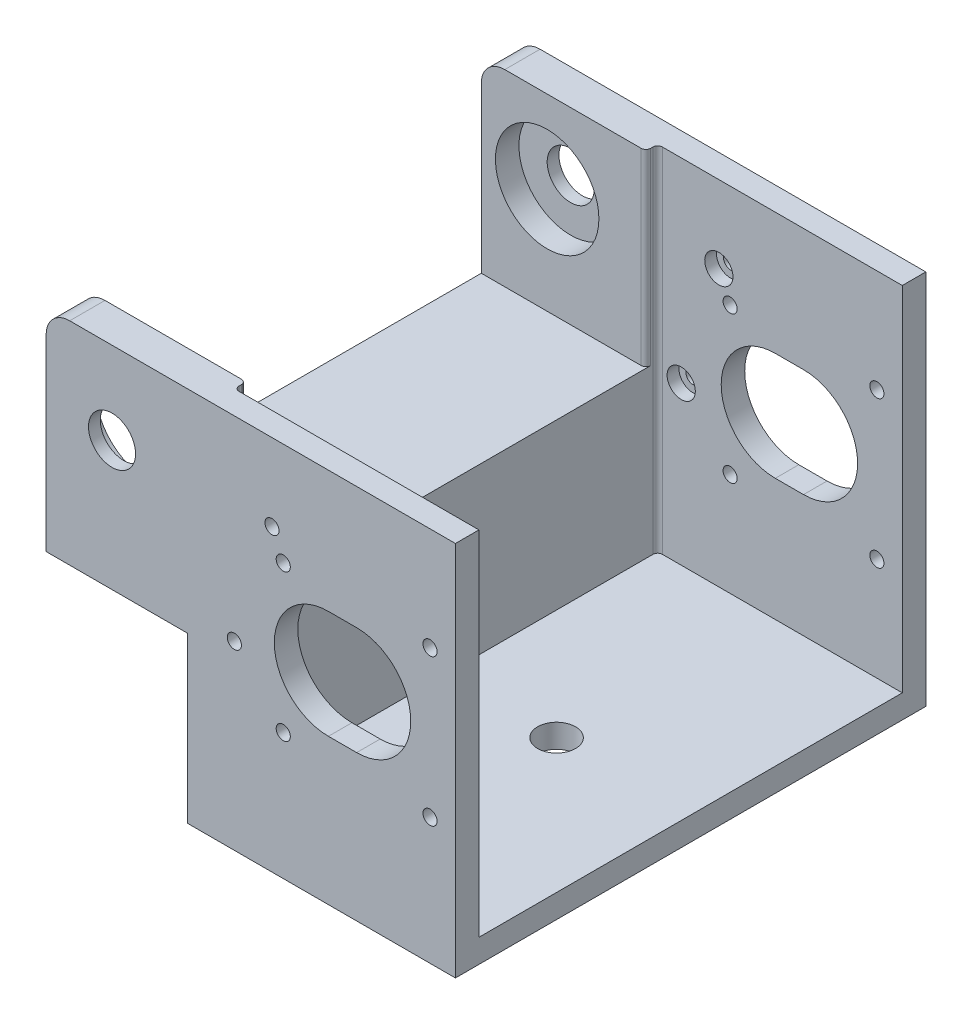
from build123d import *

# Parameters (mm, degrees)
SKETCH1_W           = 57
SKETCH1_H           = 100
BOSS_EXTRUDE1_DEPTH = 80
SKETCH3_W           = 75
SKETCH3_H           = 90
CUT_EXTRUDE1_DEPTH  = 52
SKETCH4_R           = 4.025
CUT_EXTRUDE2_DEPTH  = 114.213294272
BOSS_EXTRUDE2_DEPTH = 30
CUT_EXTRUDE5_REACH  = 112.223
SKETCH8_W           = 85
SKETCH8_H           = 40
SKETCH5_R           = 5
SKETCH5_R_2         = 1.5
CUT_EXTRUDE3_DEPTH  = 141.791512528
SKETCH9_R           = 11
SKETCH9_R_2         = 3
CUT_EXTRUDE6_DEPTH  = 47.5
FILLET1_R           = 1
FILLET2_R           = 5


with BuildPart() as part:
    # Sketch1 → Boss-Extrude1 (new body)
    with BuildSketch(Plane(origin=(0, 0, 0), x_dir=(1, 0, 0), z_dir=(0, 1, 0))):
        Rectangle(SKETCH1_W, SKETCH1_H)
    extrude(amount=BOSS_EXTRUDE1_DEPTH)

    # Sketch3 → Cut-Extrude1 (cut)
    with BuildSketch(Plane(origin=(28.5, 40, 0), x_dir=(0, 1, 0), z_dir=(-1, 0, 0))):
        with Locations((2.5, 0)):
            Rectangle(SKETCH3_W, SKETCH3_H)
    extrude(amount=CUT_EXTRUDE1_DEPTH, mode=Mode.SUBTRACT)

    # Sketch4 → Cut-Extrude2 (cut, through all)
    with BuildSketch(Plane(origin=(-40, 5, 0), x_dir=(-1, 0, 0), z_dir=(0, -1, 0))):
        with Locations(Location((-40, 0, 0), (0, 0, 90))):
            Circle(SKETCH4_R)
    extrude(amount=CUT_EXTRUDE2_DEPTH, mode=Mode.SUBTRACT)

    # Sketch7 → Boss-Extrude2 (add)
    with BuildSketch(Plane.ZY.offset(28.5)):
        Polygon((-50, 80), (-42.5, 80), (-42.5, 40), (42.5, 40), (42.5, 80), (50, 80), (50, 35), (-50, 35), align=None)
    extrude(amount=BOSS_EXTRUDE2_DEPTH)

    # Sketch8 → Cut-Extrude5 (cut, up to next)
    with BuildSketch(Plane.ZY.offset(28.5), mode=Mode.PRIVATE) as cut_extrude5_sk1:
        with Locations((0, 60)):
            Rectangle(SKETCH8_W, SKETCH8_H)
    cut_extrude5_tool1 = extrude(cut_extrude5_sk1.sketch, amount=-CUT_EXTRUDE5_REACH, mode=Mode.PRIVATE) & part.part
    add(cut_extrude5_tool1.solids().sort_by_distance((-28.5, 60, 0))[0], mode=Mode.SUBTRACT)

    # Sketch5 → Cut-Extrude3 (cut, through all)
    with BuildSketch(Plane(origin=(0, 0, -50), x_dir=(-1, 0, 0), z_dir=(0, 0, -1))):
        with Locations((44.5, 62.5)):
            Circle(SKETCH5_R)
        with Locations((-23.1, 58.1)):
            Circle(SKETCH5_R_2)
        with Locations((8.1, 58.1)):
            Circle(SKETCH5_R_2)
        with Locations((8.1, 26.9)):
            Circle(SKETCH5_R_2)
        with Locations((-23.1, 26.9)):
            Circle(SKETCH5_R_2)
        with Locations((10.5, 63.6)):
            Circle(SKETCH5_R_2)
        with Locations((18.5, 38.5)):
            Circle(SKETCH5_R_2)
        with BuildLine():
            Line((-1.5, 31), (-7.5, 31))
            ThreePointArc((-7.5, 31), (-19, 42.5), (-7.5, 54))
            Line((-7.5, 54), (-1.5, 54))
            ThreePointArc((-1.5, 54), (10, 42.5), (-1.5, 31))
        make_face()
    extrude(amount=-CUT_EXTRUDE3_DEPTH, mode=Mode.SUBTRACT)

    # Sketch9 → Cut-Extrude6 (cut, symmetric)
    with BuildSketch(Plane.XY):
        with Locations((-44.5, 62.5)):
            Circle(SKETCH9_R)
        with Locations((-10.5, 63.6)):
            Circle(SKETCH9_R_2)
        with Locations((-18.5, 38.5)):
            Circle(SKETCH9_R_2)
    extrude(amount=CUT_EXTRUDE6_DEPTH, both=True, mode=Mode.SUBTRACT)

    # Fillet1
    fillet1_edges = [part.edges().sort_by_distance(p)[0] for p in [
        (-23.5, 42.5, 45),
        (-23.5, 42.5, -45),
        (-23.5, 60, 42.5),
        (-23.5, 60, -42.5),
    ]]
    fillet(fillet1_edges, radius=FILLET1_R)

    # Fillet2
    fillet2_edges = [part.edges().sort_by_distance(p)[0] for p in [
        (-58.5, 80, 46.25),
        (-58.5, 80, -46.25),
    ]]
    fillet(fillet2_edges, radius=FILLET2_R)


solid = part.part
